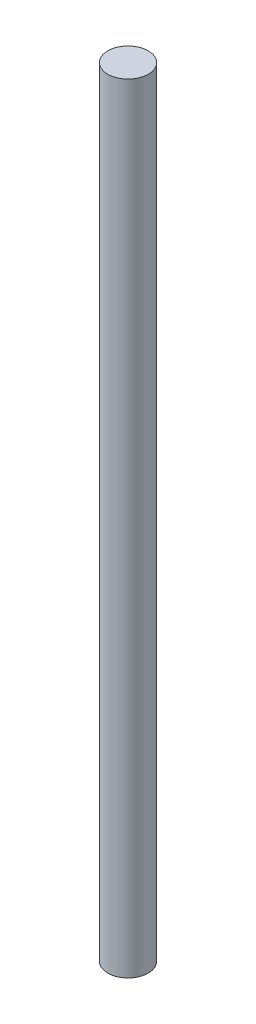
from build123d import *

# Parameters (mm, degrees)
SKETCH1_R           = 15.875
BOSS_EXTRUDE1_DEPTH = 609.6
SKETCH2_R           = 2.1971
CUT_EXTRUDE1_DEPTH  = 76.2


with BuildPart() as part:
    # Sketch1 → Boss-Extrude1 (new body)
    with BuildSketch(Plane(origin=(0, 0, 0), x_dir=(1, 0, 0), z_dir=(0, 1, 0))):
        with Locations(Location((0, 0, 0), (0, 0, 90))):
            Circle(SKETCH1_R)
    extrude(amount=BOSS_EXTRUDE1_DEPTH)

    # Sketch2 → Cut-Extrude1 (cut)
    with BuildSketch(Plane.XZ):
        with Locations(Location((0, 11.43, 0), (0, 0, 270))):
            Circle(SKETCH2_R)
        with Locations(Location((11.43, 0, 0), (0, 0, 270))):
            Circle(SKETCH2_R)
        with Locations(Location((0, -11.43, 0), (0, 0, 270))):
            Circle(SKETCH2_R)
        with Locations(Location((-11.43, 0, 0), (0, 0, 270))):
            Circle(SKETCH2_R)
    extrude(amount=-CUT_EXTRUDE1_DEPTH, mode=Mode.SUBTRACT)


solid = part.part
